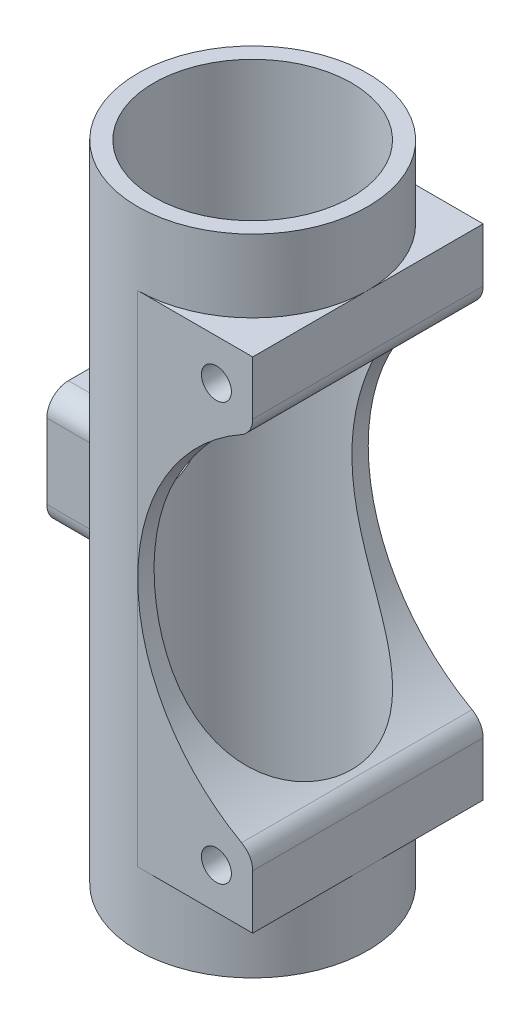
from build123d import *

# Parameters (mm, degrees)
SKETCH1_R                = 12.7
SKETCH1_R_2              = 10.9
BOSS_EXTRUDE1_DEPTH      = 71
BOSS_EXTRUDE2_DEPTH      = 63
CUT_EXTRUDE1_DEPTH       = 8
CUT_EXTRUDE2_DEPTH       = 15
CUT_EXTRUDE2_DEPTH_BACK  = 16
SKETCH4_R                = 22.297733005
SKETCH5_R                = 1.65
CUT_EXTRUDE3_DEPTH       = 4
CUT_EXTRUDE4_START       = -4
SKETCH6_R                = 1.65
CUT_EXTRUDE4_DEPTH       = 4
BOSS_EXTRUDE3_DEPTH      = 6.5
BOSS_EXTRUDE3_DEPTH_BACK = 6.5
SKETCH15_R               = 4
CUT_EXTRUDE14_DEPTH      = 7.5
BOSS_EXTRUDE4_START      = 1.75
SKETCH16_W               = 13
SKETCH16_H               = 13
SKETCH16_R               = 4
BOSS_EXTRUDE4_DEPTH      = 1.75
FILLET1_R                = 2.38
FILLET2_R                = 2.38


with BuildPart() as part:
    # Sketch1 → Boss-Extrude1 (new body)
    with BuildSketch(Plane(origin=(0, 0, 0), x_dir=(1, 0, 0), z_dir=(0, 1, 0))):
        with Locations(Location((0, 0, 0), (0, 0, 270))):
            Circle(SKETCH1_R)
        with Locations(Location((0, 0, 0), (0, 0, 270))):
            Circle(SKETCH1_R_2, mode=Mode.SUBTRACT)
    extrude(amount=BOSS_EXTRUDE1_DEPTH)

    # Sketch2 → Boss-Extrude2 (add)
    with BuildSketch(Plane.XZ):
        with BuildLine():
            Line((12.7, 12.7), (0, 12.7))
            ThreePointArc((0, 12.7), (8.980256121, 8.980256121), (12.7, 0))
            Line((12.7, 0), (12.7, 12.7))
        make_face()
        with BuildLine():
            Line((12.7, -12.7), (12.7, 0))
            ThreePointArc((12.7, 0), (8.980256121, -8.980256121), (0, -12.7))
            Line((0, -12.7), (12.7, -12.7))
        make_face()
    extrude(amount=-BOSS_EXTRUDE2_DEPTH)

    # Sketch3 → Cut-Extrude1 (cut)
    with BuildSketch(Plane.XZ):
        with BuildLine():
            Line((12.7, 12.7), (0, 12.7))
            ThreePointArc((0, 12.7), (8.980256109, 8.980256133), (12.7, 3.4e-08))
            Line((12.7, 3.4e-08), (12.7, 12.7))
        make_face()
        with BuildLine():
            Line((12.7, -12.7), (12.7, 3.4e-08))
            ThreePointArc((12.7, 3.4e-08), (8.980256133, -8.980256109), (0, -12.7))
            Line((0, -12.7), (12.7, -12.7))
        make_face()
    extrude(amount=-CUT_EXTRUDE1_DEPTH, mode=Mode.SUBTRACT)

    # Sketch4 → Cut-Extrude2 (cut, two sides: drawn at the far end of the back side and taken through both)
    with BuildSketch(Plane.XY.offset(-CUT_EXTRUDE2_DEPTH_BACK)):
        with Locations((22.331187996, 35.5)):
            Circle(SKETCH4_R)
    extrude(amount=CUT_EXTRUDE2_DEPTH + CUT_EXTRUDE2_DEPTH_BACK, mode=Mode.SUBTRACT)

    # Sketch5 → Cut-Extrude3 (cut)
    with BuildSketch(Plane(origin=(0, 0, -12.7), x_dir=(-1, 0, 0), z_dir=(0, 0, -1))):
        with Locations((-8.7, 58.5)):
            Circle(SKETCH5_R)
        with Locations((-8.7, 12.5)):
            Circle(SKETCH5_R)
    extrude(amount=-CUT_EXTRUDE3_DEPTH, mode=Mode.SUBTRACT)

    # Sketch6 → Cut-Extrude4 (cut)
    with BuildSketch(Plane.XY.offset(12.7).offset(CUT_EXTRUDE4_START)):
        with Locations(Location((8.7, 58.5, 0), (0, 0, 180))):
            Circle(SKETCH6_R)
        with Locations(Location((8.7, 12.5, 0), (0, 0, 180))):
            Circle(SKETCH6_R)
    extrude(amount=CUT_EXTRUDE4_DEPTH, mode=Mode.SUBTRACT)

    # Sketch14 → Boss-Extrude3 (add, two sides: drawn at the far end of the back side and taken through both)
    with BuildSketch(Plane(origin=(0, 35.5, 0), x_dir=(1, 0, 0), z_dir=(0, 1, 0)).offset(-BOSS_EXTRUDE3_DEPTH_BACK)):
        with BuildLine():
            Line((-14.4365, -6.5), (-14.4365, 6.5))
            Line((-14.4365, 6.5), (-10.836564596, 6.5))
            ThreePointArc((-10.836564596, 6.5), (-12.6365, 0), (-10.836564596, -6.5))
            Line((-10.836564596, -6.5), (-14.4365, -6.5))
        make_face()
    extrude(amount=BOSS_EXTRUDE3_DEPTH + BOSS_EXTRUDE3_DEPTH_BACK)

    # Sketch15 → Cut-Extrude14 (cut)
    with BuildSketch(Plane.ZY.offset(14.4365)):
        with Locations((0, 35.5)):
            Circle(SKETCH15_R)
    extrude(amount=-CUT_EXTRUDE14_DEPTH, mode=Mode.SUBTRACT)

    # Sketch16 → Boss-Extrude4 (add)
    with BuildSketch(Plane.ZY.offset(14.4365).offset(BOSS_EXTRUDE4_START)):
        with Locations((0, 35.5)):
            Rectangle(SKETCH16_W, SKETCH16_H)
        with Locations((0, 35.5)):
            Circle(SKETCH16_R, mode=Mode.SUBTRACT)
    extrude(amount=-BOSS_EXTRUDE4_DEPTH)

    # Fillet1
    fillet1_edges = [part.edges().sort_by_distance(p)[0] for p in [
        (-13.548522679, 29, 6.5),
        (-13.548522679, 29, -6.5),
        (-13.548522679, 42, -6.5),
        (-13.548522679, 42, 6.5),
    ]]
    fillet(fillet1_edges, radius=FILLET1_R)

    # Fillet2
    fillet2_edges = [part.edges().sort_by_distance(p)[0] for p in [
        (12.7, 15.389576958, 0),
        (12.7, 55.610423042, 0),
    ]]
    fillet(fillet2_edges, radius=FILLET2_R)


solid = part.part
